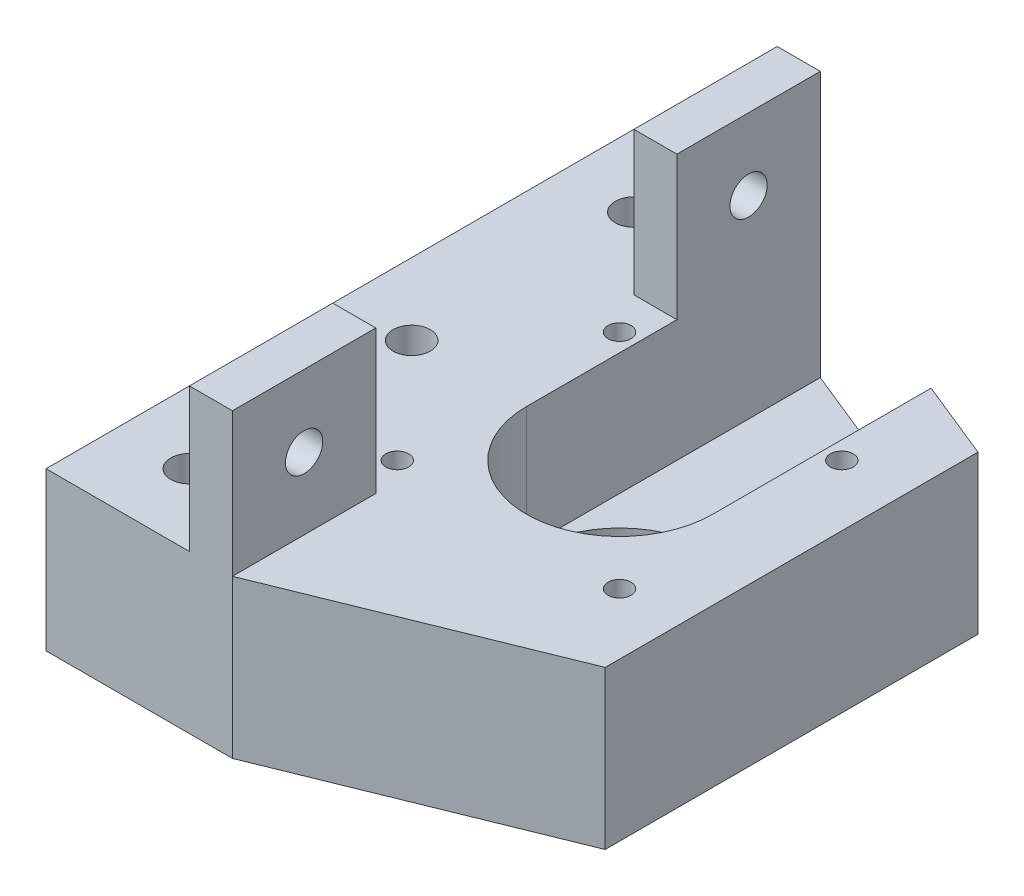
from build123d import *

# Parameters (mm, degrees)
BOSS_EXTRUDE1_DEPTH = 42
SKETCH2_W           = 20
SKETCH2_H           = 20
CUT_EXTRUDE1_DEPTH  = 112.610931364
CUT_EXTRUDE2_DEPTH  = 37
SKETCH6_R           = 2.6
CUT_EXTRUDE4_DEPTH  = 106.721331812
SKETCH5_R           = 2.6
CUT_EXTRUDE3_DEPTH  = 6
BOSS_EXTRUDE2_DEPTH = 17
SKETCH7_R           = 12.5
CUT_EXTRUDE5_DEPTH  = 110.827136902
BOSS_EXTRUDE4_DEPTH = 17
SKETCH12_R          = 1.6
CUT_EXTRUDE6_DEPTH  = 112.610931364


with BuildPart() as part:
    # Sketch1 → Boss-Extrude1 (new body)
    with BuildSketch(Plane(origin=(0, 0, 0), x_dir=(1, 0, 0), z_dir=(0, 1, 0))):
        Polygon((0, 0), (0, 82), (26, 82), (63, 67), (63, 15), (26, 0), align=None)
    extrude(amount=BOSS_EXTRUDE1_DEPTH)

    # Sketch2 → Cut-Extrude1 (cut, through all)
    with BuildSketch(Plane.XY):
        with Locations((10, 32)):
            Rectangle(SKETCH2_W, SKETCH2_H)
    extrude(amount=-CUT_EXTRUDE1_DEPTH, mode=Mode.SUBTRACT)

    # Sketch3 → Cut-Extrude2 (cut)
    with BuildSketch(Plane(origin=(0, 42, 0), x_dir=(1, 0, 0), z_dir=(0, 1, 0))):
        Polygon((26, 82), (26, 62), (20, 62), (20, 20), (26, 20), (26, 0), (63, 15), (63, 67), align=None)
    extrude(amount=-CUT_EXTRUDE2_DEPTH, mode=Mode.SUBTRACT)

    # Sketch6 → Cut-Extrude4 (cut, through all)
    with BuildSketch(Plane(origin=(0, 22, 0), x_dir=(1, 0, 0), z_dir=(0, 1, 0))):
        with Locations(Location((10, 72, 0), (0, 0, 270))):
            Circle(SKETCH6_R)
        with Locations(Location((10, 41, 0), (0, 0, 270))):
            Circle(SKETCH6_R)
        with Locations(Location((10, 10, 0), (0, 0, 270))):
            Circle(SKETCH6_R)
    extrude(amount=-CUT_EXTRUDE4_DEPTH, mode=Mode.SUBTRACT)

    # Sketch5 → Cut-Extrude3 (cut)
    with BuildSketch(Plane.ZY.offset(-20)):
        with Locations(Location((-72, 32, 0), (0, 0, 270))):
            Circle(SKETCH5_R)
        with Locations(Location((-10, 32, 0), (0, 0, 270))):
            Circle(SKETCH5_R)
    extrude(amount=-CUT_EXTRUDE3_DEPTH, mode=Mode.SUBTRACT)

    # Sketch4 → Boss-Extrude2 (add)
    with BuildSketch(Plane(origin=(0, 5, 0), x_dir=(1, 0, 0), z_dir=(0, 1, 0))):
        Polygon((26, 20), (63, 20), (63, 15), (26, 0), align=None)
    extrude(amount=BOSS_EXTRUDE2_DEPTH)

    # Sketch7 → Cut-Extrude5 (cut, through all)
    with BuildSketch(Plane(origin=(0, 5, 0), x_dir=(1, 0, 0), z_dir=(0, 1, 0))):
        with Locations(Location((39, 41, 0), (0, 0, 270))):
            Circle(SKETCH7_R)
    extrude(amount=-CUT_EXTRUDE5_DEPTH, mode=Mode.SUBTRACT)

    # Sketch10 → Boss-Extrude4 (add)
    with BuildSketch(Plane(origin=(0, 5, 0), x_dir=(1, 0, 0), z_dir=(0, 1, 0))):
        with BuildLine():
            Line((26, 62), (26, 41))
            ThreePointArc((26, 41), (39, 28), (52, 41))
            Line((52, 41), (52, 71.459459459))
            Line((52, 71.459459459), (63, 67))
            Line((63, 67), (63, 20))
            Line((63, 20), (20, 20))
            Line((20, 20), (20, 62))
            Line((20, 62), (26, 62))
        make_face()
    extrude(amount=BOSS_EXTRUDE4_DEPTH)

    # Sketch12 → Cut-Extrude6 (cut, through all)
    with BuildSketch(Plane.XZ):
        with Locations(Location((23.5, -25.5, 0), (0, 0, 270))):
            Circle(SKETCH12_R)
        with Locations(Location((54.5, -25.5, 0), (0, 0, 270))):
            Circle(SKETCH12_R)
        with Locations(Location((54.5, -56.5, 0), (0, 0, 270))):
            Circle(SKETCH12_R)
        with Locations(Location((23.5, -56.5, 0), (0, 0, 270))):
            Circle(SKETCH12_R)
    extrude(amount=-CUT_EXTRUDE6_DEPTH, mode=Mode.SUBTRACT)


solid = part.part
